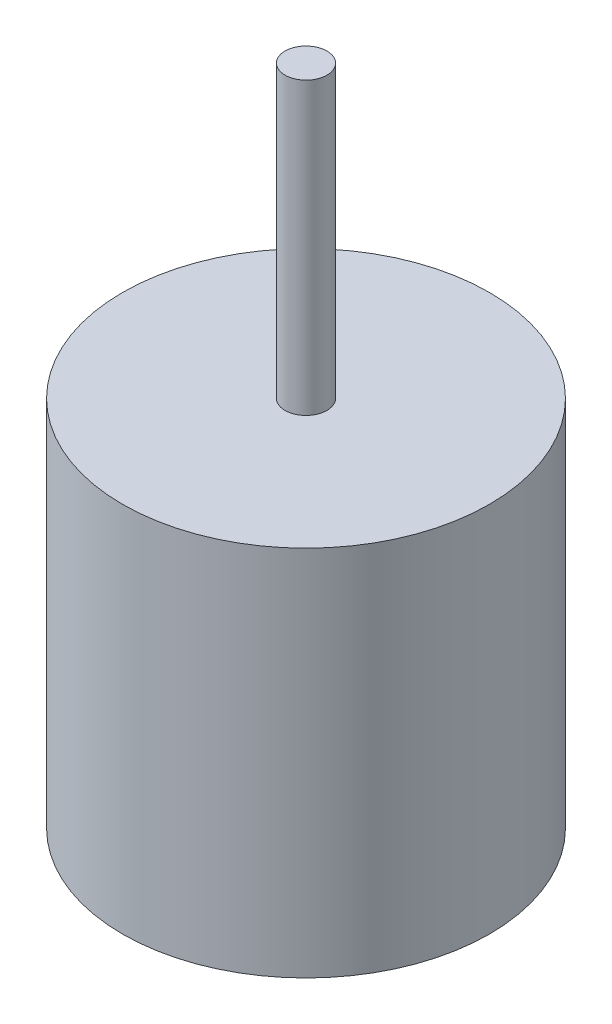
from build123d import *

# Parameters (mm, degrees)
SKETCH1_R           = 13.9
BOSS_EXTRUDE1_DEPTH = 28.2
SKETCH2_R           = 1.585
BOSS_EXTRUDE2_DEPTH = 22
SKETCH3_R           = 4.5
BOSS_EXTRUDE3_DEPTH = 5


with BuildPart() as part:
    # Sketch1 → Boss-Extrude1 (new body)
    with BuildSketch(Plane(origin=(0, 0, 0), x_dir=(1, 0, 0), z_dir=(0, 1, 0))):
        with Locations(Location((0, 0, 0), (0, 0, 270))):
            Circle(SKETCH1_R)
    extrude(amount=BOSS_EXTRUDE1_DEPTH)

    # Sketch2 → Boss-Extrude2 (add)
    with BuildSketch(Plane(origin=(0, 28.2, 0), x_dir=(1, 0, 0), z_dir=(0, 1, 0))):
        with Locations(Location((0, 0, 0), (0, 0, 270))):
            Circle(SKETCH2_R)
    extrude(amount=BOSS_EXTRUDE2_DEPTH)

    # Sketch3 → Boss-Extrude3 (add)
    with BuildSketch(Plane.XZ):
        with Locations(Location((0, 0, 0), (0, 0, 270))):
            Circle(SKETCH3_R)
    extrude(amount=BOSS_EXTRUDE3_DEPTH)


solid = part.part
